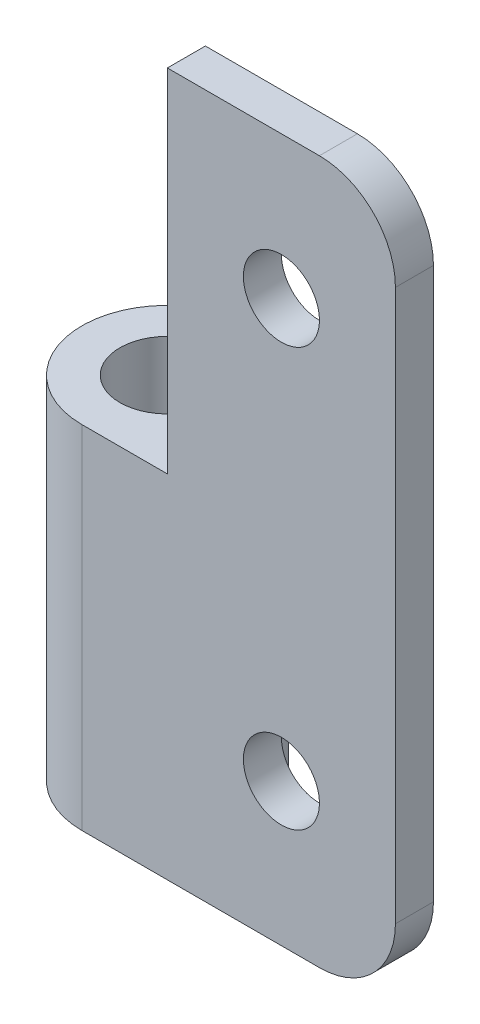
from build123d import *

# Parameters (mm, degrees)
SKETCH_1_R          = 2.5
EXTRUDE_1_DEPTH     = 18.5
SKETCH_2_W          = 12
SKETCH_2_H          = 2
EXTRUDE_2_DEPTH     = 18.5
CUT_EXTRUDE_1_REACH = 43.113
SKETCH_3_R          = 2
FILLET_1_R          = 4


with BuildPart() as part:
    # 草图1 → 凸台-拉伸1 (new body)
    with BuildSketch(Plane(origin=(0, 0, 0), x_dir=(1, 0, 0), z_dir=(0, 1, 0))):
        with BuildLine():
            Line((0, -4.5), (16.5, -4.5))
            Line((16.5, -4.5), (16.5, -2.5))
            Line((16.5, -2.5), (3.741657387, -2.5))
            ThreePointArc((3.741657387, -2.5), (-2.121320344, 3.968626967), (0, -4.5))
        make_face()
        with Locations(Location((0, 0, 0), (0, 0, 270))):
            Circle(SKETCH_1_R, mode=Mode.SUBTRACT)
    extrude(amount=EXTRUDE_1_DEPTH)

    # 草图2 → 凸台-拉伸2 (add)
    with BuildSketch(Plane(origin=(0, 18.5, 0), x_dir=(1, 0, 0), z_dir=(0, 1, 0))):
        with Locations((10.5, -3.5)):
            Rectangle(SKETCH_2_W, SKETCH_2_H)
    extrude(amount=EXTRUDE_2_DEPTH)

    # 草图3 → 切除-拉伸1 (cut, up to next)
    with BuildSketch(Plane(origin=(0, 0, 2.5), x_dir=(-1, 0, 0), z_dir=(0, 0, -1)), mode=Mode.PRIVATE) as cut_extrude_1_sk1:
        with Locations((-10.5, 7.5)):
            Circle(SKETCH_3_R)
    cut_extrude_1_tool1 = extrude(cut_extrude_1_sk1.sketch, amount=-CUT_EXTRUDE_1_REACH, mode=Mode.PRIVATE) & part.part
    # 草图3 → 切除-拉伸1 (cut, up to next)
    with BuildSketch(Plane(origin=(0, 0, 2.5), x_dir=(-1, 0, 0), z_dir=(0, 0, -1)), mode=Mode.PRIVATE) as cut_extrude_1_sk2:
        with Locations((-10.5, 29.5)):
            Circle(SKETCH_3_R)
    cut_extrude_1_tool2 = extrude(cut_extrude_1_sk2.sketch, amount=-CUT_EXTRUDE_1_REACH, mode=Mode.PRIVATE) & part.part
    add(cut_extrude_1_tool1.solids().sort_by_distance((10.5, 7.5, 2.5))[0], mode=Mode.SUBTRACT)
    add(cut_extrude_1_tool2.solids().sort_by_distance((10.5, 29.5, 2.5))[0], mode=Mode.SUBTRACT)

    # 圆角1
    fillet_1_edges = [part.edges().sort_by_distance(p)[0] for p in [
        (16.5, 37, 3.5),
        (16.5, 0, 3.5),
    ]]
    fillet(fillet_1_edges, radius=FILLET_1_R)


solid = part.part
